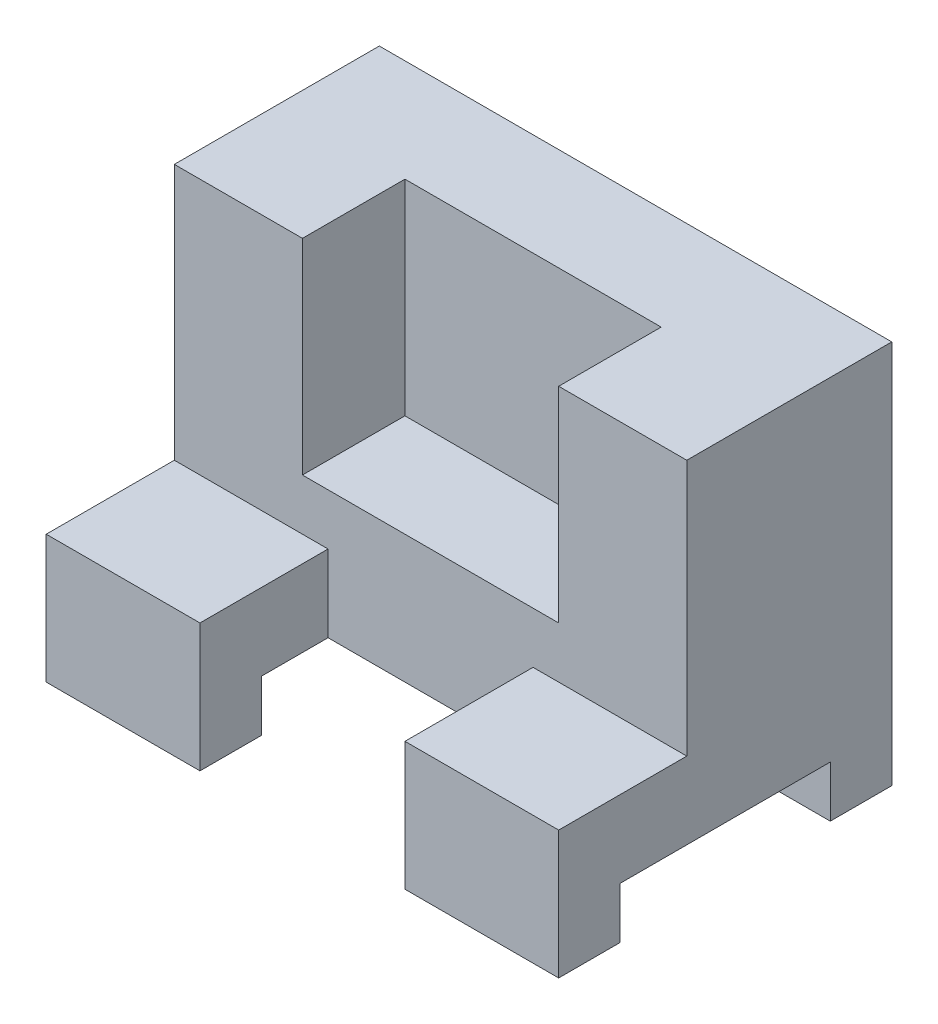
from build123d import *

# Parameters (mm, degrees)
SKETCH1_W           = 100
SKETCH1_H           = 65
BOSS_EXTRUDE1_DEPTH = 40
SKETCH2_W           = 50
SKETCH2_H           = 20
CUT_EXTRUDE1_DEPTH  = 40
SKETCH3_W           = 30
SKETCH3_H           = 15
SKETCH3_H_2         = 10
BOSS_EXTRUDE2_DEPTH = 25
SKETCH4_W           = 100
SKETCH4_H           = 12
BOSS_EXTRUDE3_DEPTH = 10
SKETCH5_W           = 13
SKETCH5_H           = 10
CUT_EXTRUDE2_DEPTH  = 141.890028036


with BuildPart() as part:
    # Sketch1 → Boss-Extrude1 (new body)
    with BuildSketch(Plane.XY):
        with Locations((50, -32.5)):
            Rectangle(SKETCH1_W, SKETCH1_H)
    extrude(amount=BOSS_EXTRUDE1_DEPTH)

    # Sketch2 → Cut-Extrude1 (cut)
    with BuildSketch(Plane(origin=(0, 0, 0), x_dir=(1, 0, 0), z_dir=(0, 1, 0))):
        with Locations((50, -30)):
            Rectangle(SKETCH2_W, SKETCH2_H)
    extrude(amount=-CUT_EXTRUDE1_DEPTH, mode=Mode.SUBTRACT)

    # Sketch3 → Boss-Extrude2 (add)
    with BuildSketch(Plane.XY.offset(40)):
        with Locations((15, -57.5)):
            Rectangle(SKETCH3_W, SKETCH3_H)
        with Locations((85, -57.5)):
            Rectangle(SKETCH3_W, SKETCH3_H)
        with Locations((15, -70)):
            Rectangle(SKETCH3_W, SKETCH3_H_2)
        with Locations((85, -70)):
            Rectangle(SKETCH3_W, SKETCH3_H_2)
    extrude(amount=BOSS_EXTRUDE2_DEPTH)

    # Sketch4 → Boss-Extrude3 (add)
    with BuildSketch(Plane.XZ.offset(65)):
        with Locations((50, 6)):
            Rectangle(SKETCH4_W, SKETCH4_H)
    extrude(amount=BOSS_EXTRUDE3_DEPTH)

    # Sketch5 → Cut-Extrude2 (cut, through all)
    with BuildSketch(Plane(origin=(100, 0, 0), x_dir=(0, 0, -1), z_dir=(1, 0, 0))):
        with Locations((-46.5, -70)):
            Rectangle(SKETCH5_W, SKETCH5_H)
    extrude(amount=-CUT_EXTRUDE2_DEPTH, mode=Mode.SUBTRACT)


solid = part.part
